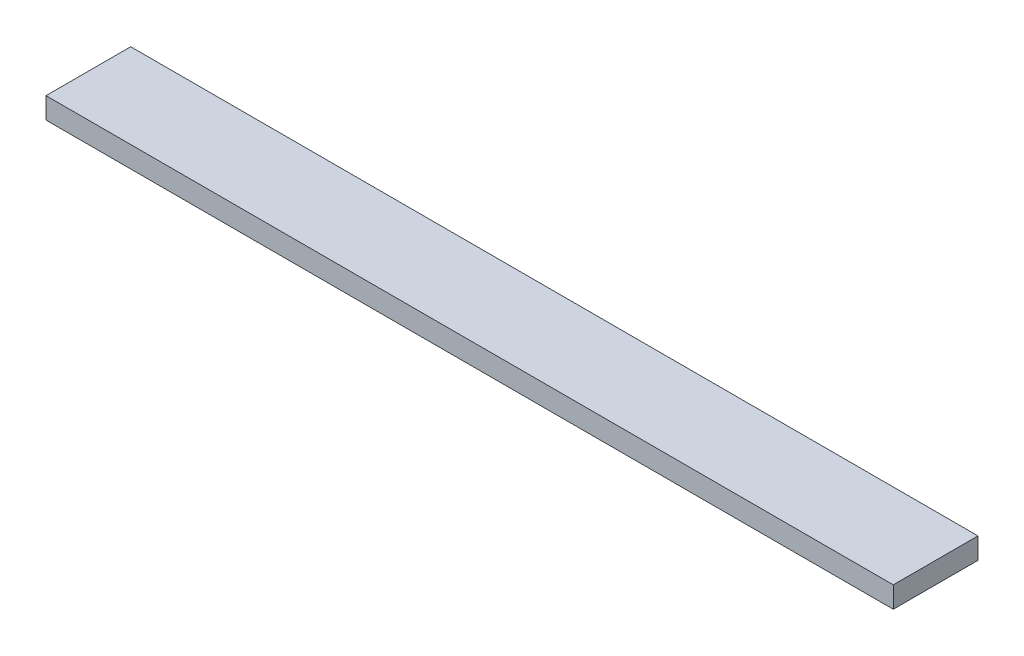
from build123d import *

# Parameters (mm, degrees)
SKETCH1_W           = 400
SKETCH1_H           = 10
BOSS_EXTRUDE2_DEPTH = 40


with BuildPart() as part:
    # Sketch1 → Boss-Extrude2 (new body)
    with BuildSketch(Plane.XY):
        with Locations((0, -195)):
            Rectangle(SKETCH1_W, SKETCH1_H)
    extrude(amount=BOSS_EXTRUDE2_DEPTH)


solid = part.part
